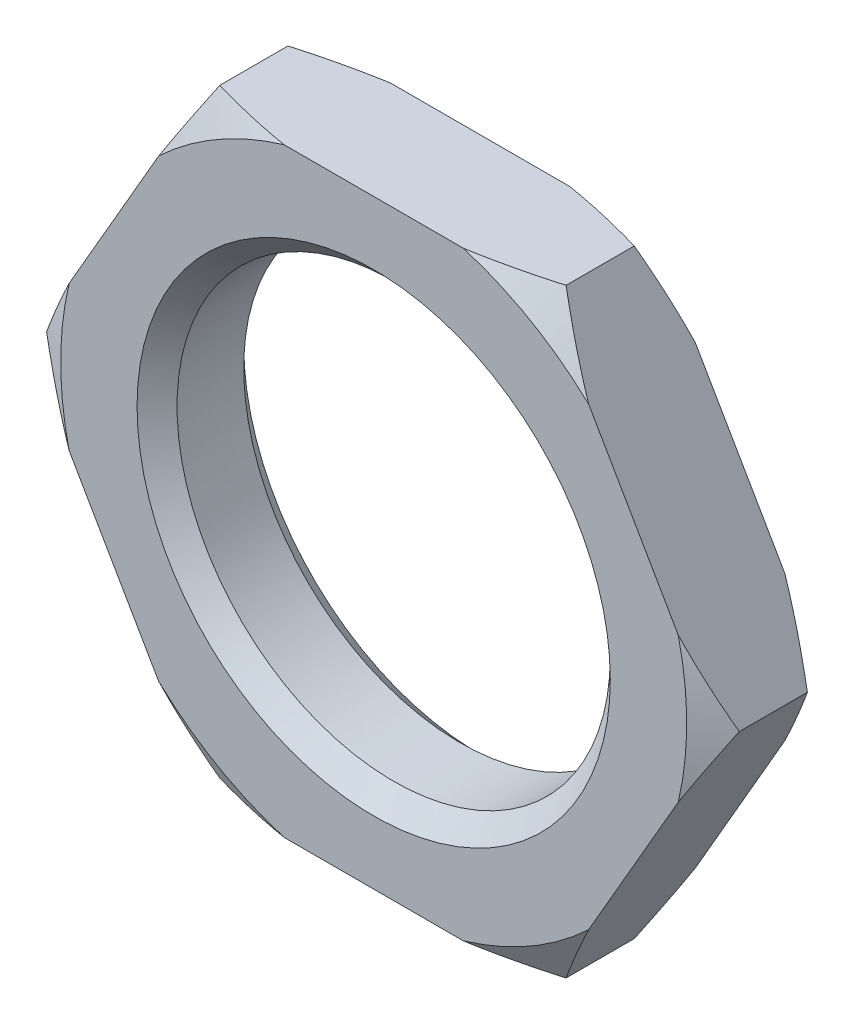
from build123d import *

# Parameters (mm, degrees)
ESQUISSE1_R        = 3.25
BOSS_EXTRU_1_DEPTH = 1.6
CHANFREIN1_SIZE    = 0.3


with BuildPart() as part:
    # Esquisse1 → Boss.-Extru.1 (new body)
    with BuildSketch(Plane.XY):
        Polygon((5.196152423, 0), (2.598076211, 4.5), (-2.598076211, 4.5), (-5.196152423, 0), (-2.598076211, -4.5), (2.598076211, -4.5), align=None)
        Circle(ESQUISSE1_R, mode=Mode.SUBTRACT)
    extrude(amount=BOSS_EXTRU_1_DEPTH)

    # Esquisse2 → Enlèvement de matière-Révolution1 (revolve, cut)
    with BuildSketch(Plane(origin=(0, 0, 0), x_dir=(1, 0, 0), z_dir=(0, 1, 0))):
        Polygon((-4.696152423, 0), (-5.196152423, -0.288675135), (-5.196152423, -1.311324865), (-4.696152423, -1.6), (-6.196152423, -1.6), (-6.196152423, 0), align=None)
    revolve(axis=Axis((0, 0, 0), (0, 0, 1)), mode=Mode.SUBTRACT)

    # Chanfrein1
    chanfrein1_edges = [part.edges().sort_by_distance(p)[0] for p in [
        (-3.25, 0, 0),
        (-3.25, 0, 1.6),
    ]]
    chamfer(chanfrein1_edges, length=CHANFREIN1_SIZE)


solid = part.part
